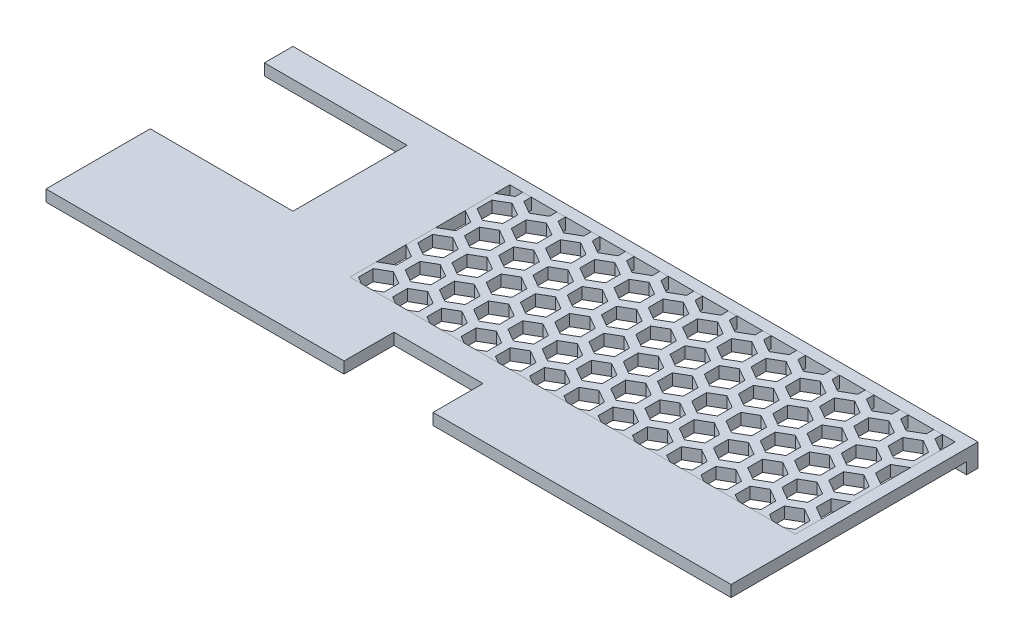
from build123d import *

# Parameters (mm, degrees)
SKETCH_1_W                  = 120
SKETCH_1_H                  = 45
SKETCH_1_W_2                = 15.6
SKETCH_1_H_2                = 8
EXTRUDE_1_DEPTH             = 2
SKETCH_2_W                  = 25
SKETCH_2_H                  = 20
CUT_EXTRUDE_1_DEPTH         = 2
SKETCH_3_W                  = 120
SKETCH_3_H                  = 2
EXTRUDE_3_DEPTH             = 2
SKETCH_4_W                  = 120
SKETCH_4_H                  = 4
EXTRUDE_4_DEPTH             = 2
SKETCH_6_W                  = 78
SKETCH_6_H                  = 28
CUT_EXTRUDE_2_DEPTH         = 2
SKETCH_7_W                  = 78
SKETCH_7_H                  = 28
EXTRUDE_5_DEPTH             = 2
CUT_EXTRUDE_3_DEPTH         = 2
PATTERN_LINEAR_2_COUNT      = 16
PATTERN_LINEAR_2_PITCH      = 6
PATTERN_LINEAR_2_COUNT_DIR2 = 3
PATTERN_LINEAR_2_PITCH_DIR2 = 10.392304845
SKETCH_10_W                 = 120
SKETCH_10_H                 = 4
CUT_EXTRUDE_4_DEPTH         = 3.75
SKETCH_11_W                 = 15.6
SKETCH_11_H                 = 2
CUT_EXTRUDE_5_DEPTH         = 5


with BuildPart() as part:
    # 草图1 → 凸台-拉伸1 (new body)
    with BuildSketch(Plane(origin=(0, 0, 0), x_dir=(1, 0, 0), z_dir=(0, 1, 0))):
        with Locations((-27.156551364, 10.260570434)):
            Rectangle(SKETCH_1_W, SKETCH_1_H)
        with Locations((-27.156551364, -5.739429566)):
            Rectangle(SKETCH_1_W_2, SKETCH_1_H_2, mode=Mode.SUBTRACT)
    extrude(amount=EXTRUDE_1_DEPTH)

    # 草图2 → 切除-拉伸1 (cut)
    with BuildSketch(Plane(origin=(0, 2, 0), x_dir=(1, 0, 0), z_dir=(0, 1, 0))):
        with Locations((-74.656551364, 17.760570434)):
            Rectangle(SKETCH_2_W, SKETCH_2_H)
    extrude(amount=-CUT_EXTRUDE_1_DEPTH, mode=Mode.SUBTRACT)

    # 草图3 → 凸台-拉伸3 (add)
    with BuildSketch(Plane.XZ):
        with Locations((-27.156551364, -31.760570434)):
            Rectangle(SKETCH_3_W, SKETCH_3_H)
    extrude(amount=EXTRUDE_3_DEPTH)

    # 草图4 → 凸台-拉伸4 (add)
    with BuildSketch(Plane.XY.offset(12.239429566)):
        with Locations((-27.156551364, 0)):
            Rectangle(SKETCH_4_W, SKETCH_4_H)
    extrude(amount=EXTRUDE_4_DEPTH)

    # 草图6 → 切除-拉伸2 (cut)
    with BuildSketch(Plane(origin=(0, 2, 0), x_dir=(1, 0, 0), z_dir=(0, 1, 0))):
        with Locations((-8.156551364, 16.760570434)):
            Rectangle(SKETCH_6_W, SKETCH_6_H)
    extrude(amount=-CUT_EXTRUDE_2_DEPTH, mode=Mode.SUBTRACT)

    # 草图10 → 切除-拉伸4 (cut)
    with BuildSketch(Plane.XY.offset(14.239429566)):
        with Locations((-27.156551364, 0)):
            Rectangle(SKETCH_10_W, SKETCH_10_H)
    extrude(amount=-CUT_EXTRUDE_4_DEPTH, mode=Mode.SUBTRACT)

    # 草图11 → 切除-拉伸5 (cut)
    with BuildSketch(Plane(origin=(0, 0, 9.739429566), x_dir=(-1, 0, 0), z_dir=(0, 0, -1))):
        with Locations((27.156551364, 1)):
            Rectangle(SKETCH_11_W, SKETCH_11_H)
    extrude(amount=-CUT_EXTRUDE_5_DEPTH, mode=Mode.SUBTRACT)


with BuildPart() as body_2:
    # 草图7 → 凸台-拉伸5 (new body)
    with BuildSketch(Plane(origin=(0, 2, 0), x_dir=(1, 0, 0), z_dir=(0, 1, 0))):
        with Locations((-8.156551364, 16.760570434)):
            Rectangle(SKETCH_7_W, SKETCH_7_H)
    extrude(amount=-EXTRUDE_5_DEPTH)

    # 草图8 → 切除-拉伸3 (cut)
    with BuildSketch(Plane(origin=(0, 2, 0), x_dir=(1, 0, 0), z_dir=(0, 1, 0))):
        Polygon((30.843448636, 28.162494222), (33.093448636, 29.461532328), (33.093448636, 32.059608539), (30.843448636, 33.358646645), (28.593448636, 32.059608539), (28.593448636, 29.461532328), align=None)
        Polygon((27.843448636, 22.9663418), (30.093448636, 24.265379905), (30.093448636, 26.863456117), (27.843448636, 28.162494222), (25.593448636, 26.863456117), (25.593448636, 24.265379905), align=None)
    cut_extrude_3 = extrude(amount=-CUT_EXTRUDE_3_DEPTH, mode=Mode.SUBTRACT)

    # 阵列(线性)2: Cut-Extrude 3 16 × 3
    with Locations(*[(-i * PATTERN_LINEAR_2_PITCH, 0, j * PATTERN_LINEAR_2_PITCH_DIR2) for i in range(PATTERN_LINEAR_2_COUNT) for j in range(PATTERN_LINEAR_2_COUNT_DIR2) if (i, j) != (0, 0)]):
        add(cut_extrude_3, mode=Mode.SUBTRACT)


solid = Compound([part.part, body_2.part])
